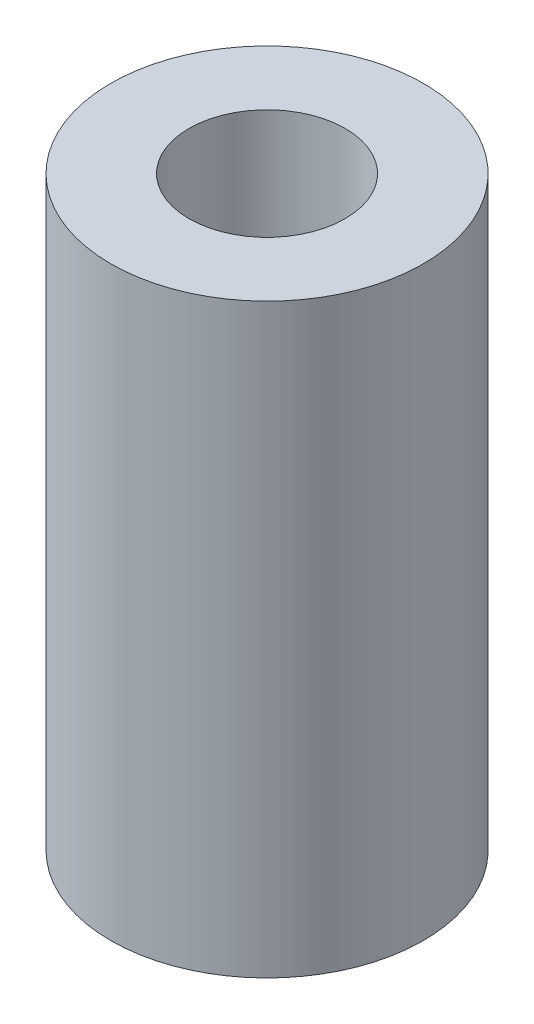
from build123d import *

# Parameters (mm, degrees)
SKETCH1_R           = 4
SKETCH1_R_2         = 2
BOSS_EXTRUDE1_DEPTH = 15


with BuildPart() as part:
    # Sketch1 → Boss-Extrude1 (new body)
    with BuildSketch(Plane(origin=(0, 0, 0), x_dir=(1, 0, 0), z_dir=(0, 1, 0))):
        with Locations(Location((0, 0, 0), (0, 0, 270))):
            Circle(SKETCH1_R)
        with Locations(Location((0, 0, 0), (0, 0, 270))):
            Circle(SKETCH1_R_2, mode=Mode.SUBTRACT)
    extrude(amount=BOSS_EXTRUDE1_DEPTH)


solid = part.part
